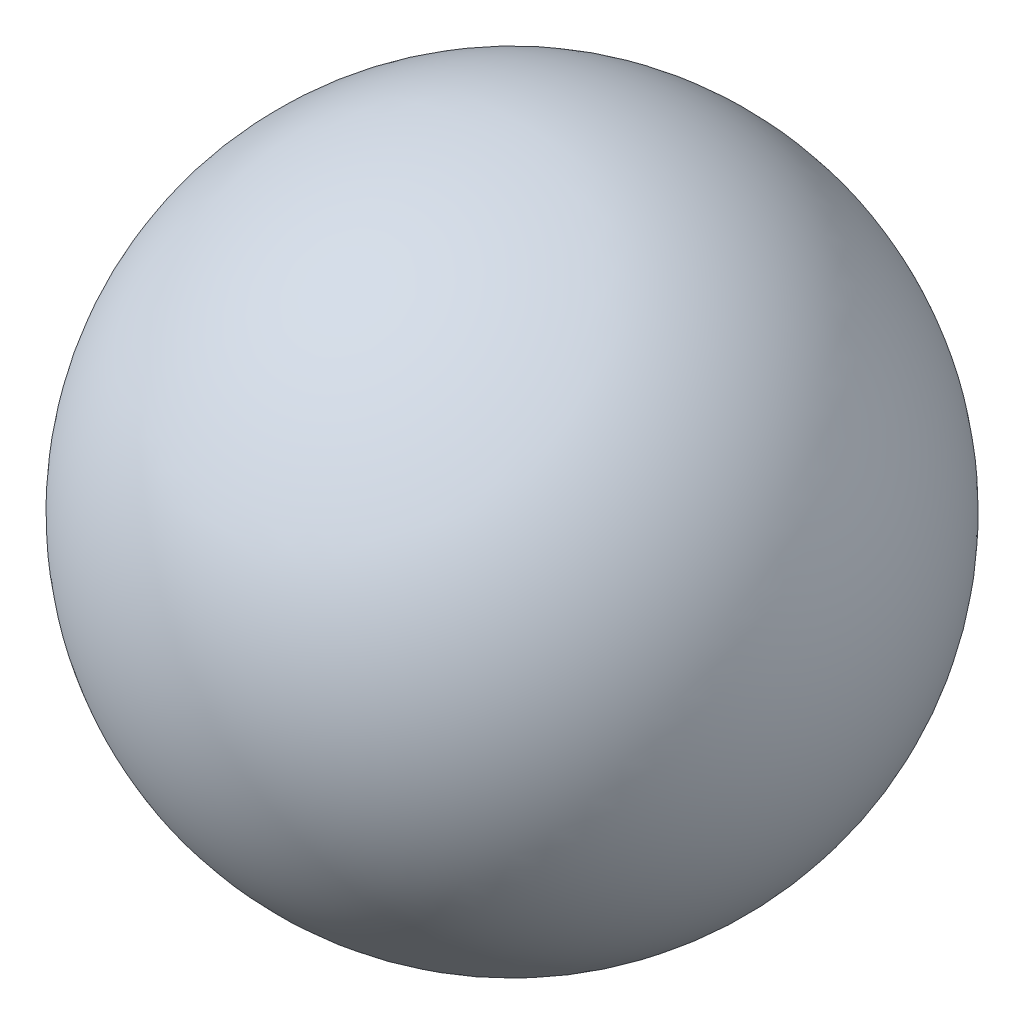
from build123d import *


with BuildPart() as part:
    # 草图1 → 旋转1 (revolve)
    with BuildSketch(Plane(origin=(0, 0, 0), x_dir=(1, 0, 0), z_dir=(0, 1, 0))):
        with BuildLine():
            Line((0, -1.325), (0, 1.325))
            ThreePointArc((0, 1.325), (1.325, 0), (0, -1.325))
        make_face()
    revolve(axis=Axis((0, 0, 1.325), (0, 0, -1)))


solid = part.part
